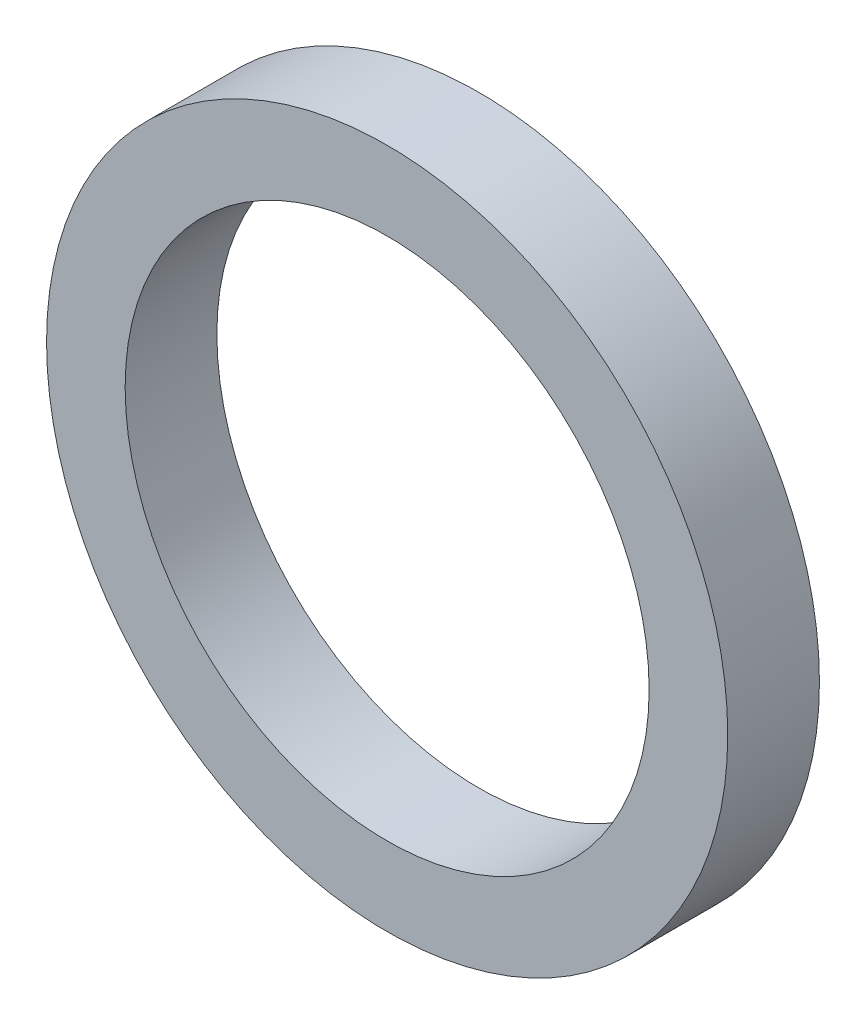
from build123d import *

# Parameters (mm, degrees)
SKETCH1_R           = 26
SKETCH1_R_2         = 20
BOSS_EXTRUDE1_DEPTH = 7


with BuildPart() as part:
    # Sketch1 → Boss-Extrude1 (new body)
    with BuildSketch(Plane.XY):
        Circle(SKETCH1_R)
        Circle(SKETCH1_R_2, mode=Mode.SUBTRACT)
    extrude(amount=BOSS_EXTRUDE1_DEPTH)


solid = part.part
